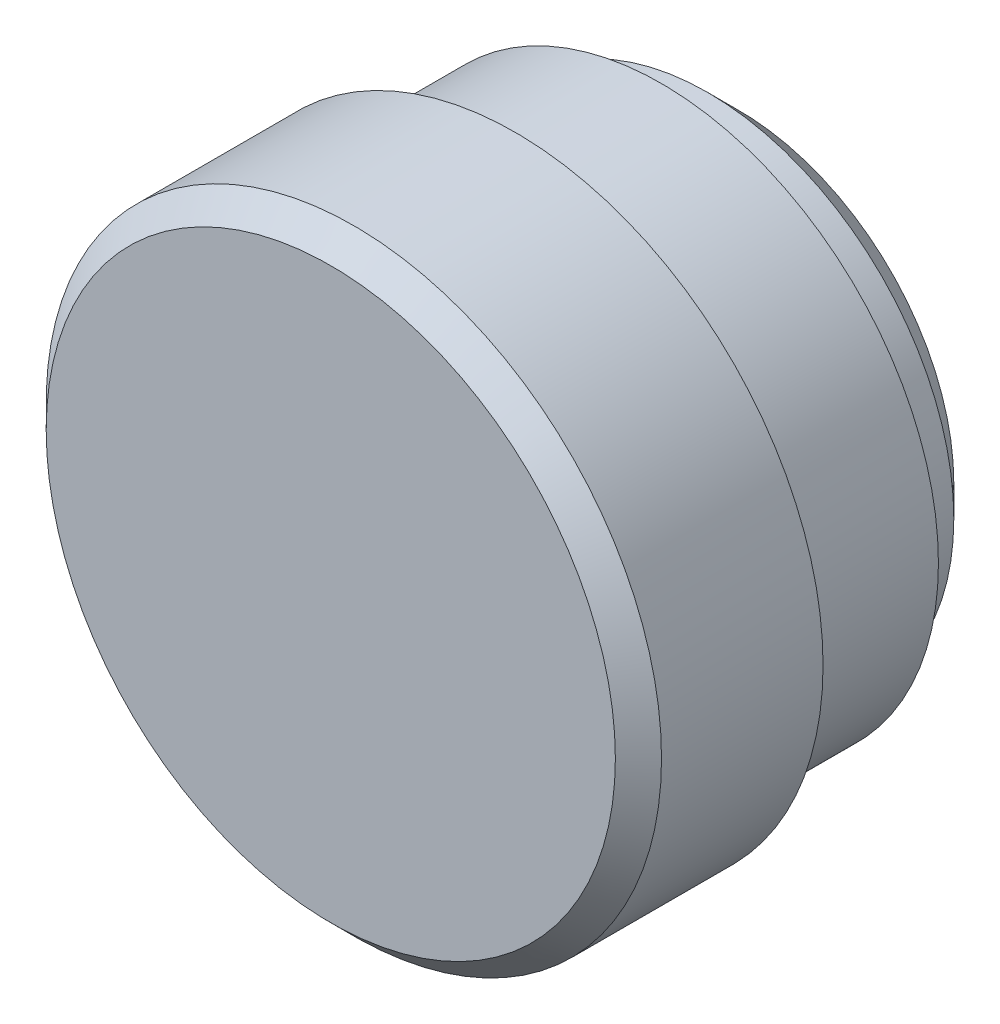
from build123d import *

# Parameters (mm, degrees)
SKETCH1_R           = 8
BOSS_EXTRUDE1_DEPTH = 2.5
SKETCH2_R           = 9
BOSS_EXTRUDE2_DEPTH = 4.5
SKETCH3_R           = 8
BOSS_EXTRUDE3_DEPTH = 0.25
SKETCH4_R           = 10
BOSS_EXTRUDE4_DEPTH = 6
SKETCH5_W           = 5
SKETCH5_H           = 5
CUT_EXTRUDE1_DEPTH  = 5
CHAMFER1_SIZE       = 1
CHAMFER2_SIZE       = 0.75


with BuildPart() as part:
    # Sketch1 → Boss-Extrude1 (new body)
    with BuildSketch(Plane.XY):
        Circle(SKETCH1_R)
    extrude(amount=BOSS_EXTRUDE1_DEPTH)

    # Sketch2 → Boss-Extrude2 (add)
    with BuildSketch(Plane.XY.offset(2.5)):
        Circle(SKETCH2_R)
    extrude(amount=BOSS_EXTRUDE2_DEPTH)

    # Sketch3 → Boss-Extrude3 (add)
    with BuildSketch(Plane.XY.offset(7)):
        Circle(SKETCH3_R)
    extrude(amount=BOSS_EXTRUDE3_DEPTH)

    # Sketch4 → Boss-Extrude4 (add)
    with BuildSketch(Plane.XY.offset(7.25)):
        Circle(SKETCH4_R)
    extrude(amount=BOSS_EXTRUDE4_DEPTH)

    # Sketch5 → Cut-Extrude1 (cut)
    with BuildSketch(Plane(origin=(0, 0, 0), x_dir=(-1, 0, 0), z_dir=(0, 0, -1))):
        Rectangle(SKETCH5_W, SKETCH5_H)
    extrude(amount=-CUT_EXTRUDE1_DEPTH, mode=Mode.SUBTRACT)

    # Chamfer1
    chamfer1_edges = [part.edges().sort_by_distance(p)[0] for p in [
        (-8, 0, 0),
    ]]
    chamfer(chamfer1_edges, length=CHAMFER1_SIZE)

    # Chamfer2
    chamfer2_edges = [part.edges().sort_by_distance(p)[0] for p in [
        (-10, 0, 13.25),
    ]]
    chamfer(chamfer2_edges, length=CHAMFER2_SIZE)


solid = part.part
